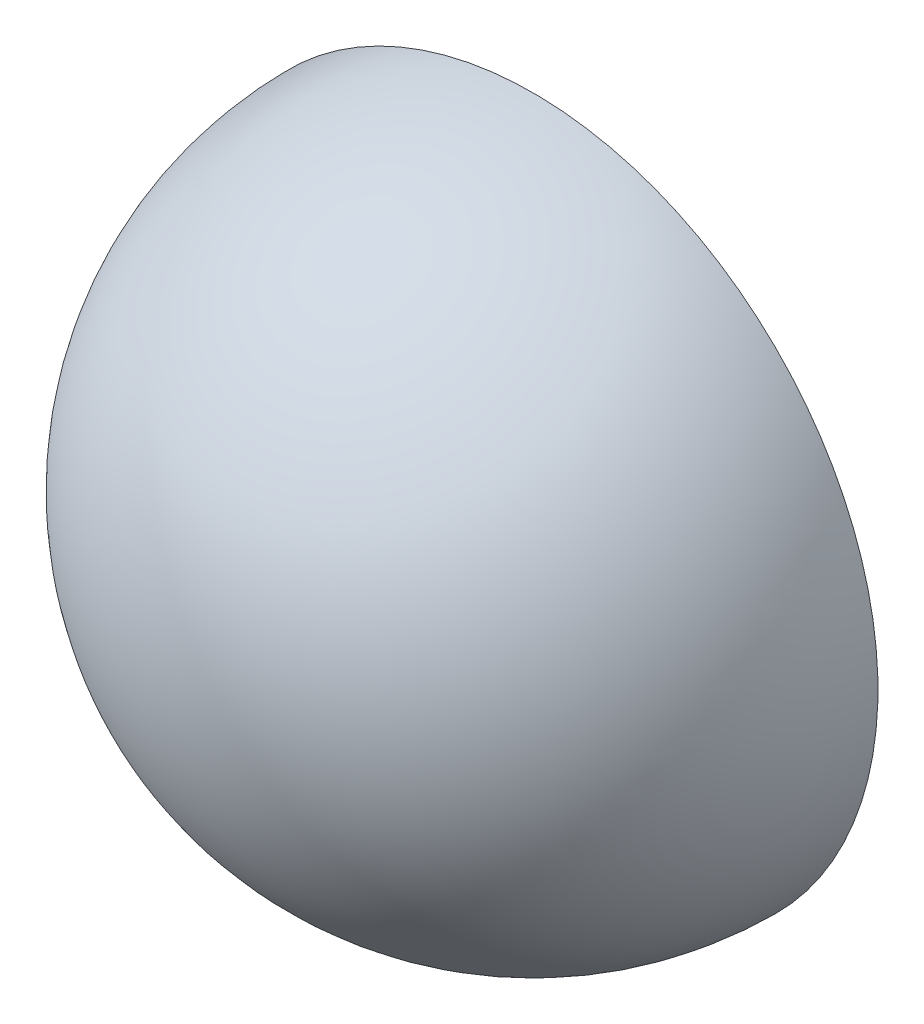
from build123d import *

# Parameters (mm, degrees)
REVOLVE_3_ANGLE = 180


with BuildPart() as part:
    # 草图1 → 旋转3 (revolve)
    with BuildSketch(Plane.XY):
        with BuildLine():
            Line((0, 100), (0, 98))
            ThreePointArc((0, 98), (98, 0), (0, -98))
            Line((0, -98), (0, -100))
            ThreePointArc((0, -100), (100, 0), (0, 100))
        make_face()
    revolve(axis=Axis((0, 100, 0), (0, -1, 0)), revolution_arc=REVOLVE_3_ANGLE)


solid = part.part
